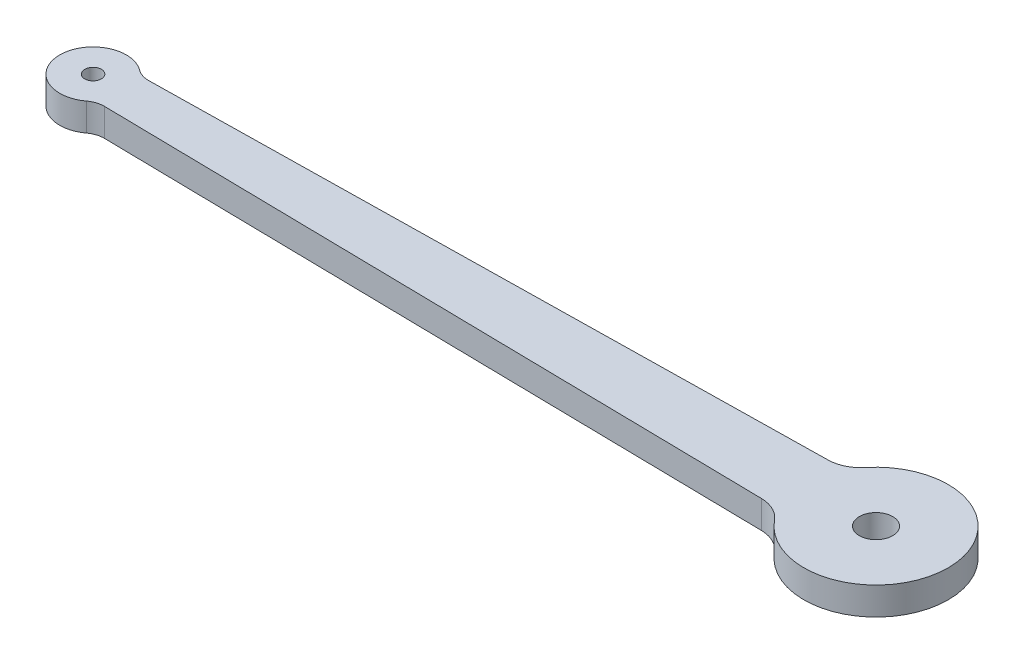
from build123d import *

# Parameters (mm, degrees)
BOSS_EXTRUDE1_DEPTH = 2.5
CUT_EXTRUDE1_REACH  = 44.327
SKETCH2_R           = 0.75
SKETCH2_R_2         = 1.5


with BuildPart() as part:
    # Sketch1 → Boss-Extrude1 (new body)
    with BuildSketch(Plane(origin=(0, 0, 0), x_dir=(1, 0, 0), z_dir=(0, 1, 0))):
        with BuildLine():
            Line((-32.216386231, 2), (27.934070474, 3))
            ThreePointArc((27.934070474, 3), (29.194347957, 3.300786008), (30.210243769, 4.104979553))
            ThreePointArc((30.210243769, 4.104979553), (41.75, 0), (30.210243769, -4.104979553))
            ThreePointArc((30.210243769, -4.104979553), (29.194347957, -3.300786008), (27.934070474, -3))
            Line((27.934070474, -3), (-32.216386231, -2))
            ThreePointArc((-32.216386231, -2), (-32.86638269, -2.097194277), (-33.449778955, -2.3998342))
            ThreePointArc((-33.449778955, -2.3998342), (-38.25, 0), (-33.449778955, 2.3998342))
            ThreePointArc((-33.449778955, 2.3998342), (-32.86638269, 2.097194277), (-32.216386231, 2))
        make_face()
    extrude(amount=BOSS_EXTRUDE1_DEPTH)

    # Sketch2 → Cut-Extrude1 (cut, up to next)
    with BuildSketch(Plane(origin=(0, 2.5, 0), x_dir=(1, 0, 0), z_dir=(0, 1, 0)), mode=Mode.PRIVATE) as cut_extrude1_sk1:
        with Locations(Location((-35.25, 0, 0), (0, 0, 270))):
            Circle(SKETCH2_R)
    cut_extrude1_tool1 = extrude(cut_extrude1_sk1.sketch, amount=-CUT_EXTRUDE1_REACH, mode=Mode.PRIVATE) & part.part
    # Sketch2 → Cut-Extrude1 (cut, up to next)
    with BuildSketch(Plane(origin=(0, 2.5, 0), x_dir=(1, 0, 0), z_dir=(0, 1, 0)), mode=Mode.PRIVATE) as cut_extrude1_sk2:
        with Locations(Location((35.25, 0, 0), (0, 0, 270))):
            Circle(SKETCH2_R_2)
    cut_extrude1_tool2 = extrude(cut_extrude1_sk2.sketch, amount=-CUT_EXTRUDE1_REACH, mode=Mode.PRIVATE) & part.part
    add(cut_extrude1_tool1.solids().sort_by_distance((-35.25, 2.5, 0))[0], mode=Mode.SUBTRACT)
    add(cut_extrude1_tool2.solids().sort_by_distance((35.25, 2.5, 0))[0], mode=Mode.SUBTRACT)


solid = part.part
